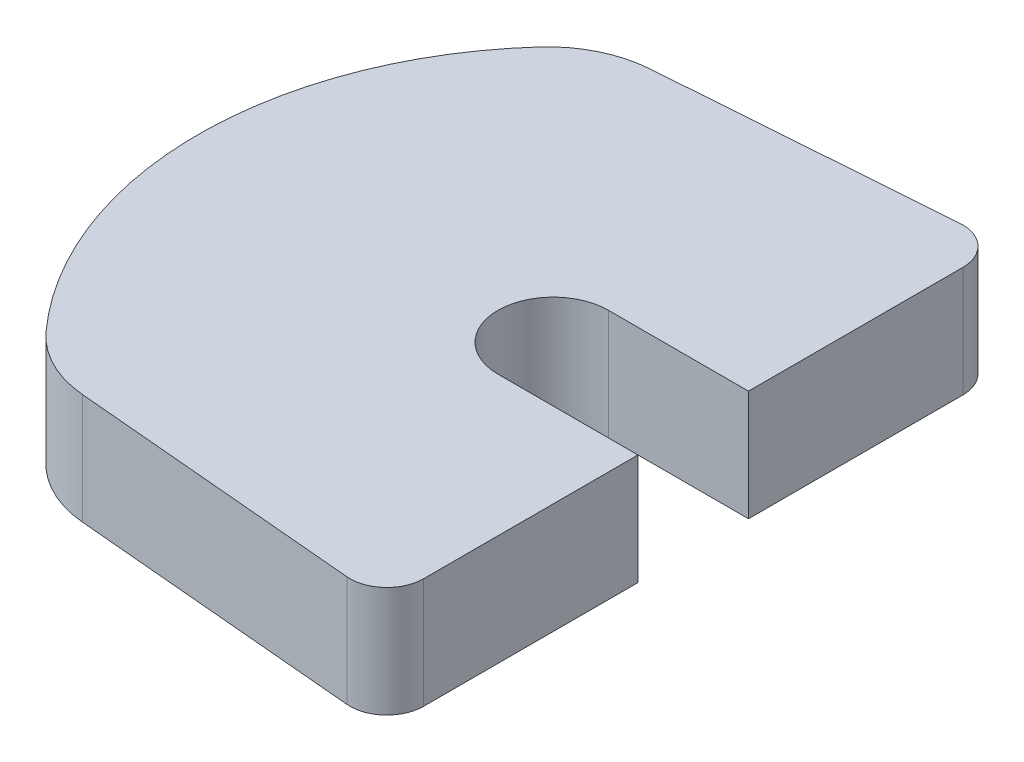
from build123d import *

# Parameters (mm, degrees)
BOSS_EXTRUDE1_DEPTH = 3


with BuildPart() as part:
    # Sketch1 → Boss-Extrude1 (new body)
    with BuildSketch(Plane(origin=(0, 0, 0), x_dir=(1, 0, 0), z_dir=(0, 1, 0))):
        with BuildLine():
            Line((0, 0), (3.8, 0))
            Line((3.8, 0), (3.8, -5.815800771))
            ThreePointArc((3.8, -5.815800771), (3.475312858, -6.553332156), (2.712094913, -6.811929626))
            Line((2.712094913, -6.811929626), (-5.163624241, -6.116923376))
            ThreePointArc((-5.163624241, -6.116923376), (-6.238909118, -5.813137084), (-7.128441398, -5.136930013))
            ThreePointArc((-7.128441398, -5.136930013), (-9.7, 1.557713995), (-7.128441398, 8.252358003))
            ThreePointArc((-7.128441398, 8.252358003), (-6.219292824, 8.938259935), (-5.120004532, 9.235880232))
            Line((-5.120004532, 9.235880232), (2.726634816, 9.813105915))
            ThreePointArc((2.726634816, 9.813105915), (3.48067423, 9.548387007), (3.8, 8.815800771))
            Line((3.8, 8.815800771), (3.8, 3))
            Line((3.8, 3), (0, 3))
            ThreePointArc((0, 3), (-1.5, 1.5), (0, 0))
        make_face()
    extrude(amount=BOSS_EXTRUDE1_DEPTH)


solid = part.part
